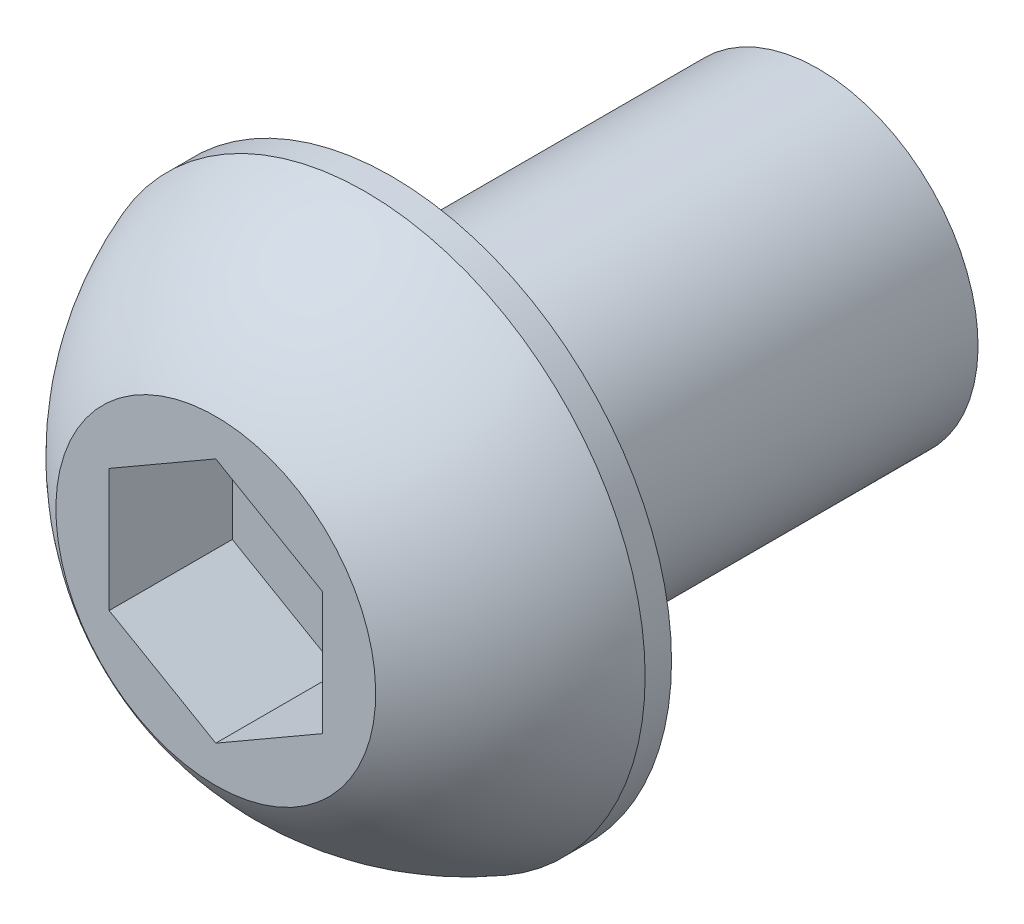
from build123d import *

# Parameters (mm, degrees)
SKETCH1_W          = 8
SKETCH1_H          = 3
CUT_EXTRUDE2_DEPTH = 2.31


with BuildPart() as part:
    # Sketch1 → Revolve1 (revolve)
    with BuildSketch(Plane(origin=(0, 0, 0), x_dir=(0, 0, -1), z_dir=(1, 0, 0))):
        with Locations((7.3, 1.5)):
            Rectangle(SKETCH1_W, SKETCH1_H)
    revolve(axis=Axis((0, 0, -11.3), (0, 0, 1)))

    # Sketch7 → Revolve2 (revolve)
    with BuildSketch(Plane(origin=(0, 0, 0), x_dir=(0, 0, -1), z_dir=(1, 0, 0)), mode=Mode.PRIVATE) as revolve2_sk:
        with BuildLine():
            Line((2.805, 5.25), (3.3, 5.25))
            Line((3.3, 5.25), (3.3, 0))
            Line((3.3, 0), (0, 0))
            Line((0, 0), (0, 3))
            ThreePointArc((0, 3), (1.216479019, 4.356906156), (2.805, 5.25))
        make_face()
    revolve(revolve2_sk.sketch.rotate(Axis((0, 0, 0), (0, 0, -1)), 180), axis=Axis((0, 0, 0), (0, 0, -1)))

    # Sketch5 → Cut-Extrude2 (cut)
    with BuildSketch(Plane.XY):
        Polygon((2, -1.154700538), (2, 1.154700538), (0, 2.309401077), (-2, 1.154700538), (-2, -1.154700538), (0, -2.309401077), align=None)
    extrude(amount=-CUT_EXTRUDE2_DEPTH, mode=Mode.SUBTRACT)


solid = part.part
